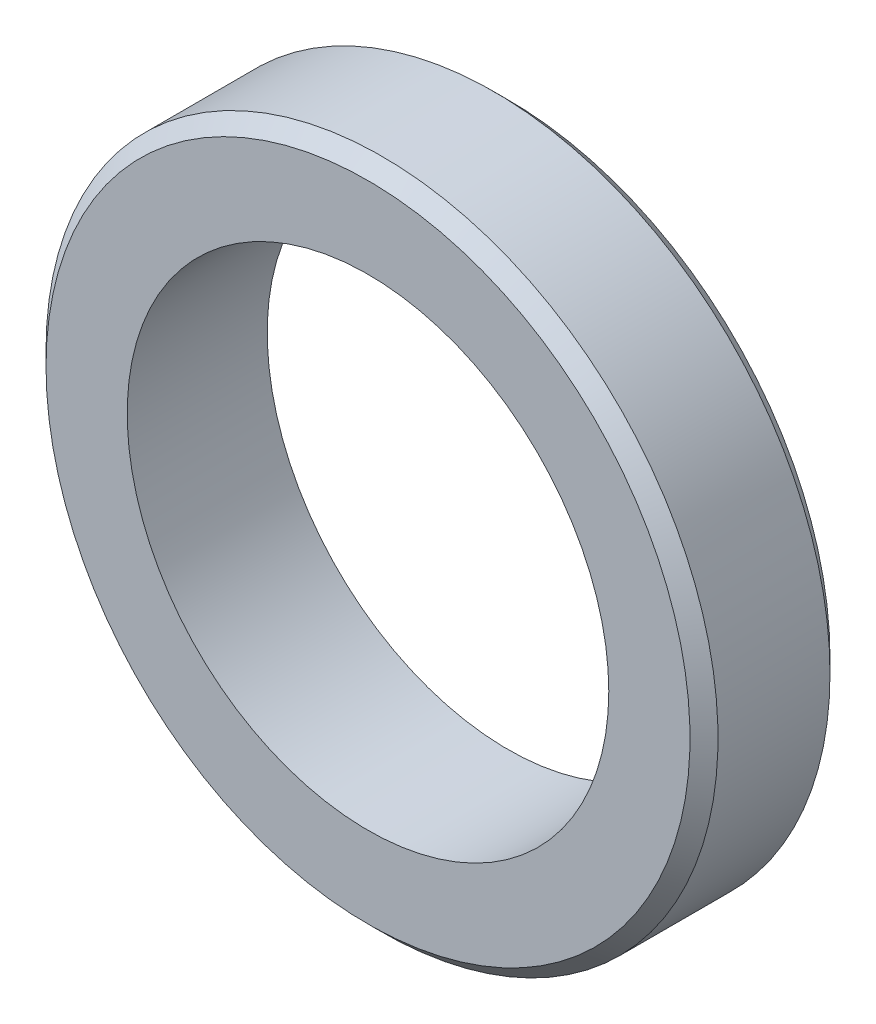
from build123d import *

# Parameters (mm, degrees)
SCHIZZO1_R                   = 12
ESTRUSIONE_ESTRUSIONE1_DEPTH = 5
SCHIZZO3_R                   = 8.6
TAGLIO_ESTRUSIONE1_DEPTH     = 18.691806013
SMUSSO1_SIZE                 = 0.5
SMUSSO2_SIZE                 = 0.5


with BuildPart() as part:
    # Schizzo1 → Estrusione-Estrusione1 (new body)
    with BuildSketch(Plane.XY):
        Circle(SCHIZZO1_R)
    extrude(amount=ESTRUSIONE_ESTRUSIONE1_DEPTH)

    # Schizzo3 → Taglio-Estrusione1 (cut, through all)
    with BuildSketch(Plane.XY.offset(5)):
        Circle(SCHIZZO3_R)
    extrude(amount=-TAGLIO_ESTRUSIONE1_DEPTH, mode=Mode.SUBTRACT)

    # Smusso1
    smusso1_edges = [part.edges().sort_by_distance(p)[0] for p in [
        (-12, 0, 5),
    ]]
    chamfer(smusso1_edges, length=SMUSSO1_SIZE)

    # Smusso2
    smusso2_edges = [part.edges().sort_by_distance(p)[0] for p in [
        (-12, 0, 0),
    ]]
    chamfer(smusso2_edges, length=SMUSSO2_SIZE)


solid = part.part
